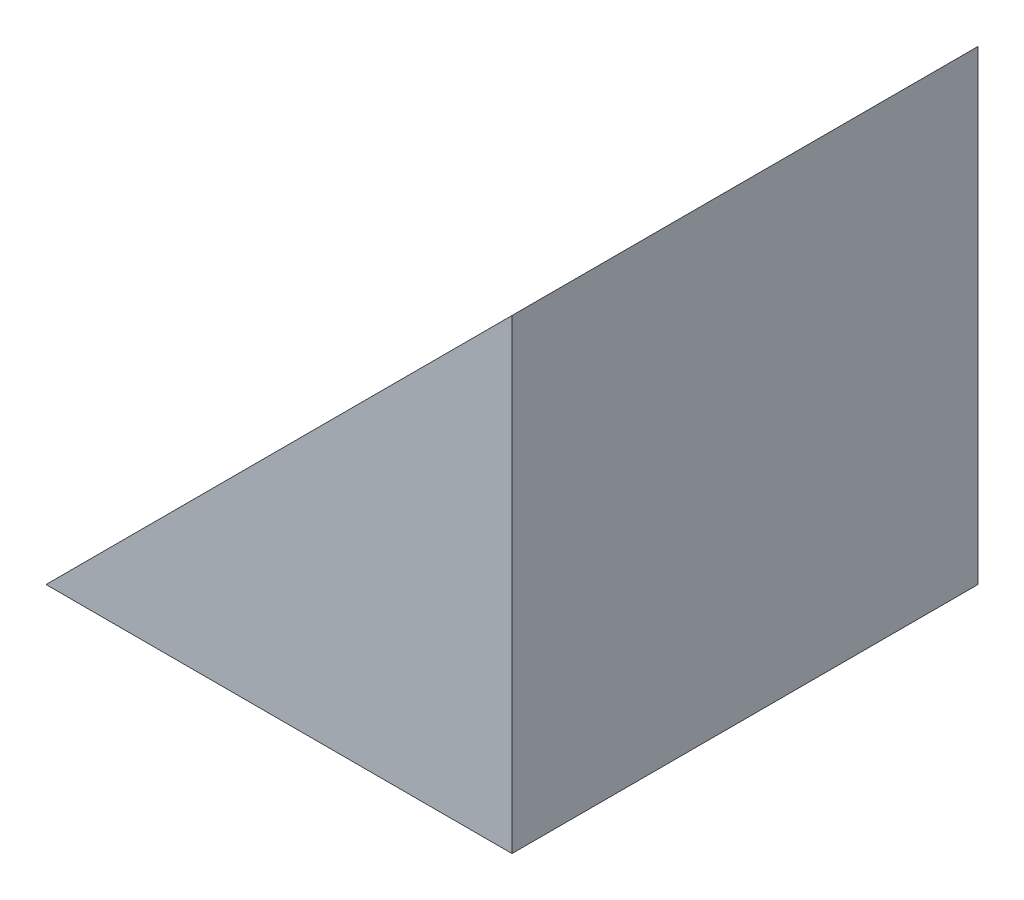
from build123d import *

# Parameters (mm, degrees)
SKETCH1_W           = 2
SKETCH1_H           = 2
BOSS_EXTRUDE1_DEPTH = 2
CUT_EXTRUDE1_DEPTH  = 44.932890157


with BuildPart() as part:
    # Sketch1 → Boss-Extrude1 (new body)
    with BuildSketch(Plane.XY):
        with Locations((-3.661448455, -42.639084956)):
            Rectangle(SKETCH1_W, SKETCH1_H)
    extrude(amount=BOSS_EXTRUDE1_DEPTH)

    # Sketch2 → Cut-Extrude1 (cut, through all)
    with BuildSketch(Plane.XY.offset(2)):
        Polygon((-4.661448455, -43.639084956), (-2.661448455, -41.639084956), (-4.661448455, -41.639084956), align=None)
    extrude(amount=-CUT_EXTRUDE1_DEPTH, mode=Mode.SUBTRACT)


solid = part.part
